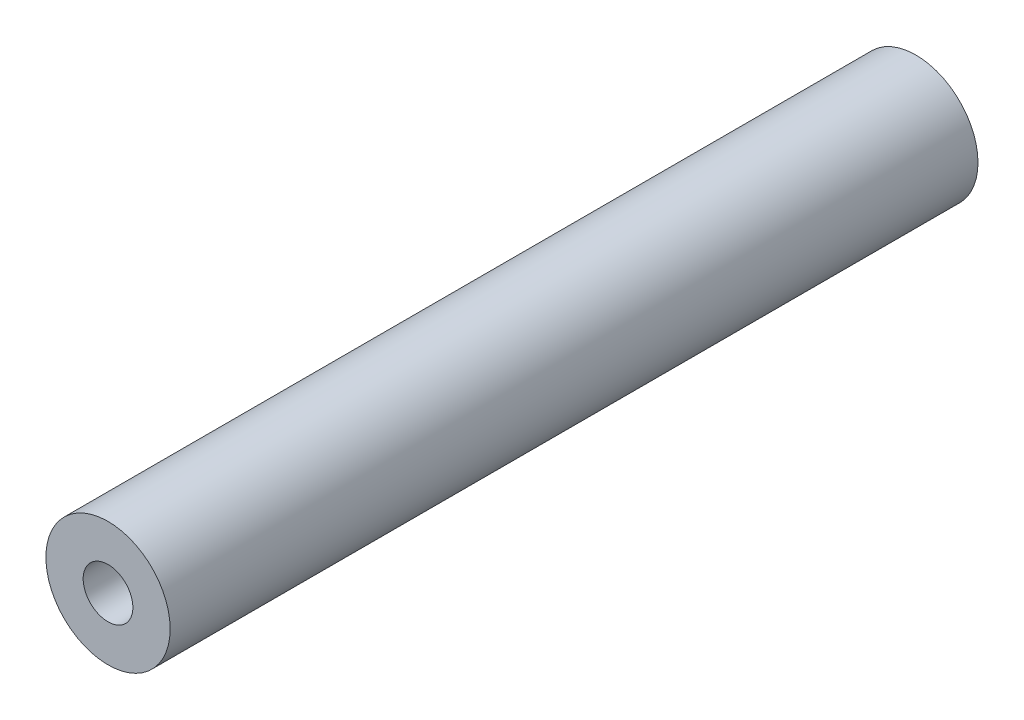
from build123d import *

# Parameters (mm, degrees)
ESBO_O1_R                = 5
ESBO_O1_R_2              = 2
RESSALTO_EXTRUS_O1_DEPTH = 65


with BuildPart() as part:
    # Esboço1 → Ressalto-extrusão1 (new body)
    with BuildSketch(Plane.XY):
        Circle(ESBO_O1_R)
        Circle(ESBO_O1_R_2, mode=Mode.SUBTRACT)
    extrude(amount=RESSALTO_EXTRUS_O1_DEPTH)


solid = part.part
